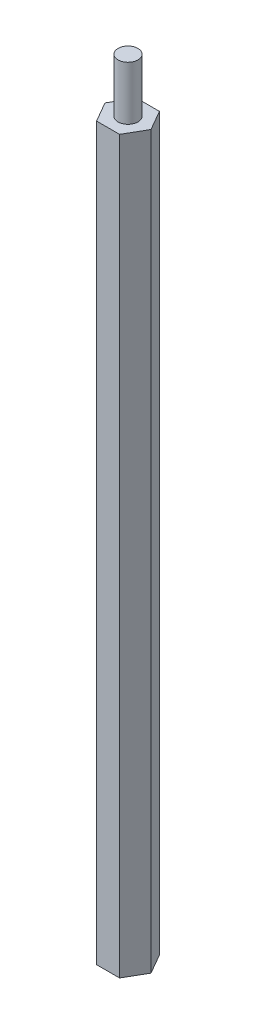
from build123d import *

# Parameters (mm, degrees)
BOSS_EXTRUDE1_DEPTH = 110
SKETCH5_R           = 1.5
BOSS_EXTRUDE2_DEPTH = 8.091605471
SKETCH6_R           = 1.5
CUT_EXTRUDE1_DEPTH  = 4


with BuildPart() as part:
    # Sketch3 → Boss-Extrude1 (new body)
    with BuildSketch(Plane(origin=(0, 0, 0), x_dir=(1, 0, 0), z_dir=(0, 1, 0))):
        Polygon((-3.464101615, 0), (-1.732050808, -3), (1.732050808, -3), (3.464101615, 0), (1.732050808, 3), (-1.732050808, 3), align=None)
    extrude(amount=BOSS_EXTRUDE1_DEPTH)

    # Sketch5 → Boss-Extrude2 (add)
    with BuildSketch(Plane(origin=(0, 110, 0), x_dir=(1, 0, 0), z_dir=(0, 1, 0))):
        with Locations(Location((0, 0, 0), (0, 0, 270))):
            Circle(SKETCH5_R)
    extrude(amount=BOSS_EXTRUDE2_DEPTH)

    # Sketch6 → Cut-Extrude1 (cut)
    with BuildSketch(Plane.XZ):
        with Locations(Location((0, 0, 0), (0, 0, 90))):
            Circle(SKETCH6_R)
    extrude(amount=-CUT_EXTRUDE1_DEPTH, mode=Mode.SUBTRACT)


solid = part.part
